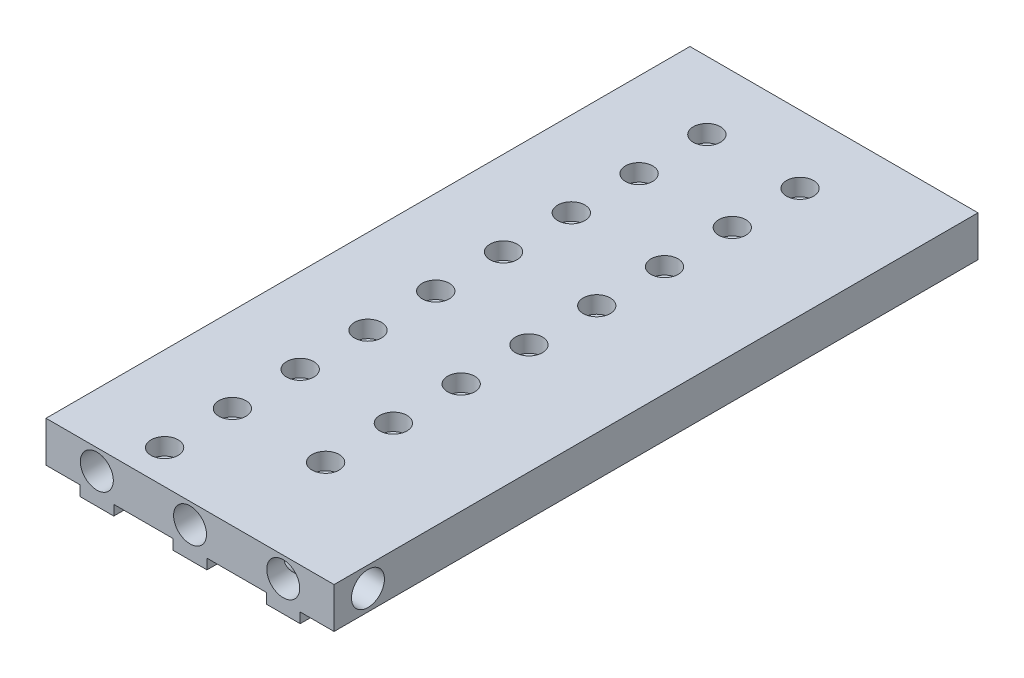
from build123d import *

# Parameters (mm, degrees)
SKETCH1_R           = 4.864
BOSS_EXTRUDE1_DEPTH = 190
SKETCH2_R           = 4.864
CUT_EXTRUDE1_DEPTH  = 40
SKETCH5_R           = 4.864
CUT_EXTRUDE3_DEPTH  = 40
SKETCH6_R           = 1.6
CUT_EXTRUDE4_DEPTH  = 209.686367547
SKETCH7_R           = 4
CUT_EXTRUDE5_DEPTH  = 5


with BuildPart() as part:
    # Sketch1 → Boss-Extrude1 (new body)
    with BuildSketch(Plane.XY):
        Polygon((37.5, 0), (37.5, -3), (47.5, -3), (47.5, 0), (65, 0), (65, -3), (75, -3), (75, 0), (85, 0), (85, 12), (0, 12), (0, 0), (10, 0), (10, -3), (20, -3), (20, 0), align=None)
        with Locations((15, 6)):
            Circle(SKETCH1_R, mode=Mode.SUBTRACT)
        with Locations((42.5, 6)):
            Circle(SKETCH1_R, mode=Mode.SUBTRACT)
        with Locations((70, 6)):
            Circle(SKETCH1_R, mode=Mode.SUBTRACT)
    extrude(amount=BOSS_EXTRUDE1_DEPTH)

    # Sketch2 → Cut-Extrude1 (cut)
    with BuildSketch(Plane(origin=(85, 0, 0), x_dir=(0, 0, -1), z_dir=(1, 0, 0))):
        with Locations((-180, 6)):
            Circle(SKETCH2_R)
    extrude(amount=-CUT_EXTRUDE1_DEPTH, mode=Mode.SUBTRACT)

    # Sketch5 → Cut-Extrude3 (cut)
    with BuildSketch(Plane.ZY):
        with Locations(Location((10, 6, 0), (0, 0, 59.070681313))):
            Circle(SKETCH5_R)
    extrude(amount=-CUT_EXTRUDE3_DEPTH, mode=Mode.SUBTRACT)

    # Sketch6 → Cut-Extrude4 (cut, through all)
    with BuildSketch(Plane(origin=(0, 12, 0), x_dir=(1, 0, 0), z_dir=(0, 1, 0))):
        with Locations(Location((25, -180, 0), (0, 0, 270))):
            Circle(SKETCH6_R)
        with Locations(Location((52.5, -160, 0), (0, 0, 270))):
            Circle(SKETCH6_R)
        with Locations(Location((52.5, -140, 0), (0, 0, 270))):
            Circle(SKETCH6_R)
        with Locations(Location((52.5, -120, 0), (0, 0, 270))):
            Circle(SKETCH6_R)
        with Locations(Location((52.5, -100, 0), (0, 0, 270))):
            Circle(SKETCH6_R)
        with Locations(Location((52.5, -80, 0), (0, 0, 270))):
            Circle(SKETCH6_R)
        with Locations(Location((52.5, -60, 0), (0, 0, 270))):
            Circle(SKETCH6_R)
        with Locations(Location((52.5, -40, 0), (0, 0, 270))):
            Circle(SKETCH6_R)
        with Locations(Location((52.5, -20, 0), (0, 0, 270))):
            Circle(SKETCH6_R)
        with Locations(Location((25, -160, 0), (0, 0, 270))):
            Circle(SKETCH6_R)
        with Locations(Location((25, -140, 0), (0, 0, 270))):
            Circle(SKETCH6_R)
        with Locations(Location((25, -120, 0), (0, 0, 270))):
            Circle(SKETCH6_R)
        with Locations(Location((25, -100, 0), (0, 0, 270))):
            Circle(SKETCH6_R)
        with Locations(Location((25, -80, 0), (0, 0, 270))):
            Circle(SKETCH6_R)
        with Locations(Location((25, -60, 0), (0, 0, 270))):
            Circle(SKETCH6_R)
        with Locations(Location((25, -40, 0), (0, 0, 270))):
            Circle(SKETCH6_R)
        with Locations(Location((25, -20, 0), (0, 0, 270))):
            Circle(SKETCH6_R)
    extrude(amount=-CUT_EXTRUDE4_DEPTH, mode=Mode.SUBTRACT)

    # Sketch7 → Cut-Extrude5 (cut)
    with BuildSketch(Plane(origin=(0, 12, 0), x_dir=(1, 0, 0), z_dir=(0, 1, 0))):
        with Locations(Location((25, -180, 0), (0, 0, 270))):
            Circle(SKETCH7_R)
        with Locations(Location((52.5, -160, 0), (0, 0, 270))):
            Circle(SKETCH7_R)
        with Locations(Location((52.5, -140, 0), (0, 0, 270))):
            Circle(SKETCH7_R)
        with Locations(Location((52.5, -120, 0), (0, 0, 270))):
            Circle(SKETCH7_R)
        with Locations(Location((52.5, -100, 0), (0, 0, 270))):
            Circle(SKETCH7_R)
        with Locations(Location((52.5, -80, 0), (0, 0, 270))):
            Circle(SKETCH7_R)
        with Locations(Location((52.5, -60, 0), (0, 0, 270))):
            Circle(SKETCH7_R)
        with Locations(Location((52.5, -40, 0), (0, 0, 270))):
            Circle(SKETCH7_R)
        with Locations(Location((52.5, -20, 0), (0, 0, 270))):
            Circle(SKETCH7_R)
        with Locations(Location((25, -160, 0), (0, 0, 270))):
            Circle(SKETCH7_R)
        with Locations(Location((25, -140, 0), (0, 0, 270))):
            Circle(SKETCH7_R)
        with Locations(Location((25, -120, 0), (0, 0, 270))):
            Circle(SKETCH7_R)
        with Locations(Location((25, -100, 0), (0, 0, 270))):
            Circle(SKETCH7_R)
        with Locations(Location((25, -80, 0), (0, 0, 270))):
            Circle(SKETCH7_R)
        with Locations(Location((25, -60, 0), (0, 0, 270))):
            Circle(SKETCH7_R)
        with Locations(Location((25, -40, 0), (0, 0, 270))):
            Circle(SKETCH7_R)
        with Locations(Location((25, -20, 0), (0, 0, 270))):
            Circle(SKETCH7_R)
    extrude(amount=-CUT_EXTRUDE5_DEPTH, mode=Mode.SUBTRACT)


solid = part.part
